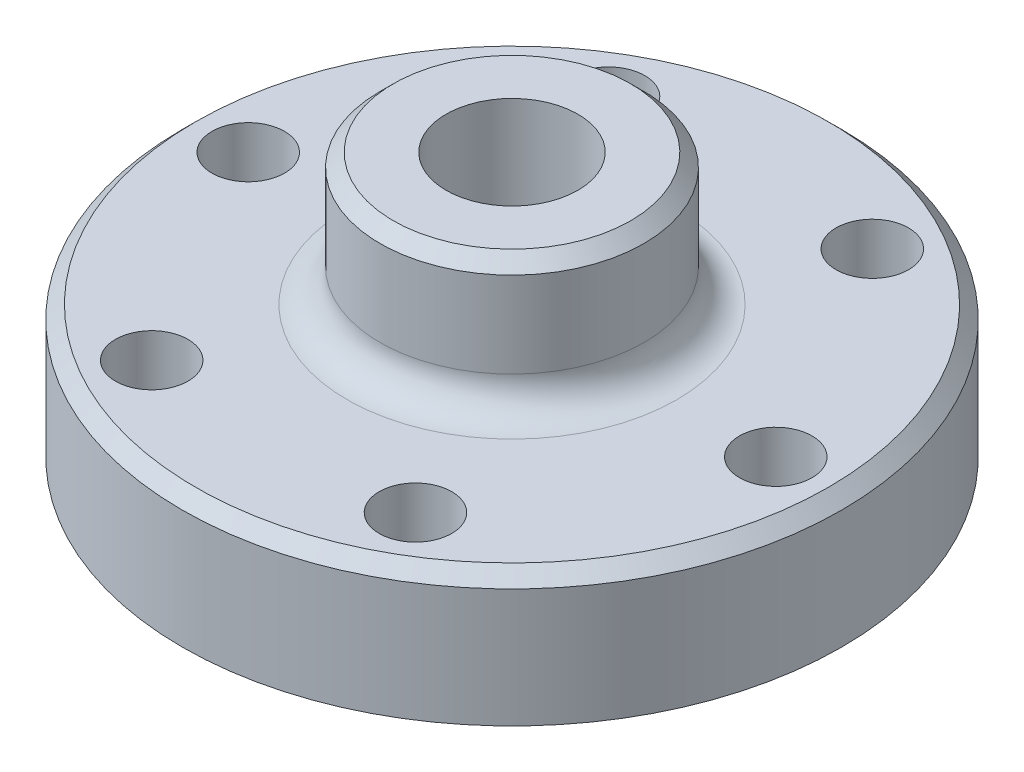
from build123d import *

# Parameters (mm, degrees)
SKETCH_2_R          = 5.5
CUT_EXTRUDE_1_DEPTH = 75.204110398


with BuildPart() as part:
    # 草图1 → 旋转1 (revolve)
    with BuildSketch(Plane.XY, mode=Mode.PRIVATE) as revolve_1_sk:
        with BuildLine():
            ThreePointArc((-25, 22.5), (-21.464466094, 23.964466094), (-20, 27.5))
            Line((-20, 27.5), (-20, 40.5))
            Line((-20, 40.5), (-18, 42.5))
            Line((-18, 42.5), (-10, 42.5))
            Line((-10, 42.5), (-10, 0))
            Line((-10, 0), (-30, 0))
            Line((-30, 0), (-30, 2.5))
            Line((-30, 2.5), (-50, 2.5))
            Line((-50, 2.5), (-50, 20.5))
            Line((-50, 20.5), (-48, 22.5))
            Line((-48, 22.5), (-25, 22.5))
        make_face()
        with BuildLine():
            Line((30, 0), (30, 2.5))
            Line((30, 2.5), (50, 2.5))
            Line((50, 2.5), (50, 20.5))
            Line((50, 20.5), (48, 22.5))
            Line((48, 22.5), (25, 22.5))
            ThreePointArc((25, 22.5), (21.464466094, 23.964466094), (20, 27.5))
            Line((20, 27.5), (20, 40.5))
            Line((20, 40.5), (18, 42.5))
            Line((18, 42.5), (10, 42.5))
            Line((10, 42.5), (10, 0))
            Line((10, 0), (30, 0))
        make_face()
    revolve(revolve_1_sk.sketch.rotate(Axis((0, -641.580774088, 0), (0, 1, 0)), 180), axis=Axis((0, -641.580774088, 0), (0, 1, 0)))

    # 草图2 → 切除-拉伸1 (cut, through all)
    with BuildSketch(Plane(origin=(0, 22.5, 0), x_dir=(1, 0, 0), z_dir=(0, 1, 0))):
        with Locations(Location((-40, 0, 0), (0, 0, 180))):
            Circle(SKETCH_2_R)
        with Locations(Location((-20, 34.641016151, 0), (0, 0, 180))):
            Circle(SKETCH_2_R)
        with Locations(Location((20, 34.641016151, 0), (0, 0, 180))):
            Circle(SKETCH_2_R)
        with Locations(Location((40, 0, 0), (0, 0, 180))):
            Circle(SKETCH_2_R)
        with Locations(Location((20, -34.641016151, 0), (0, 0, 180))):
            Circle(SKETCH_2_R)
        with Locations(Location((-20, -34.641016151, 0), (0, 0, 180))):
            Circle(SKETCH_2_R)
    extrude(amount=-CUT_EXTRUDE_1_DEPTH, mode=Mode.SUBTRACT)


solid = part.part
